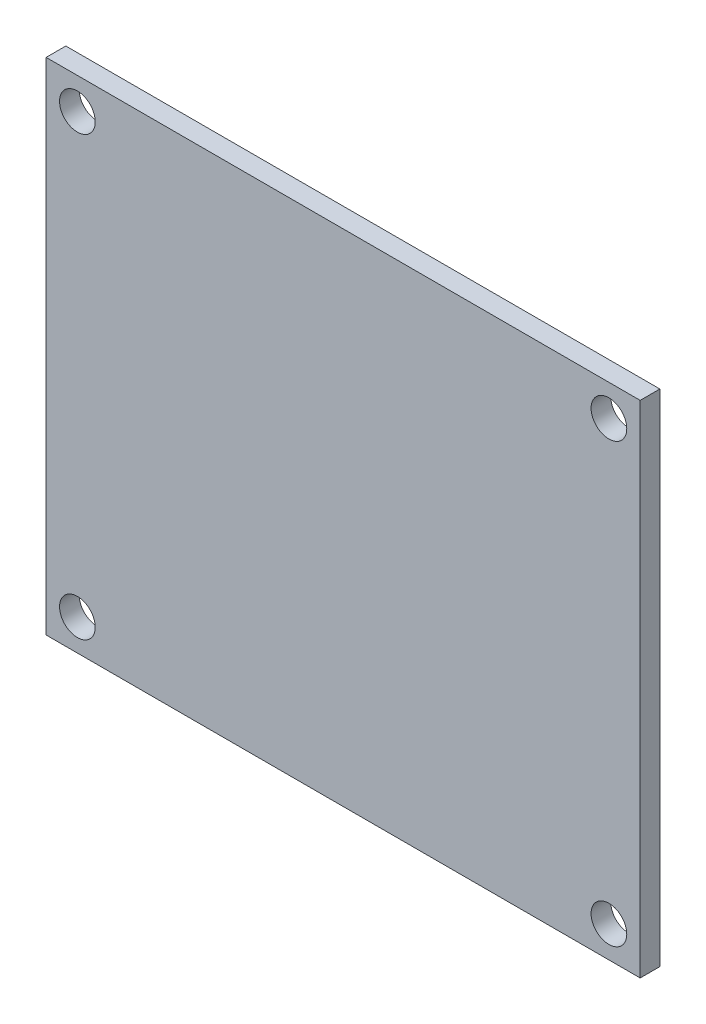
from build123d import *

# Parameters (mm, degrees)
SKETCH1_W           = 48.26
SKETCH1_H           = 40.64
SKETCH1_R           = 1.45
BOSS_EXTRUDE1_DEPTH = 1.6


with BuildPart() as part:
    # Sketch1 → Boss-Extrude1 (new body)
    with BuildSketch(Plane.XY):
        Rectangle(SKETCH1_W, SKETCH1_H)
        with Locations((-21.59, 17.78)):
            Circle(SKETCH1_R, mode=Mode.SUBTRACT)
        with Locations((21.59, 17.78)):
            Circle(SKETCH1_R, mode=Mode.SUBTRACT)
        with Locations((21.59, -17.78)):
            Circle(SKETCH1_R, mode=Mode.SUBTRACT)
        with Locations((-21.59, -17.78)):
            Circle(SKETCH1_R, mode=Mode.SUBTRACT)
    extrude(amount=BOSS_EXTRUDE1_DEPTH)


solid = part.part
